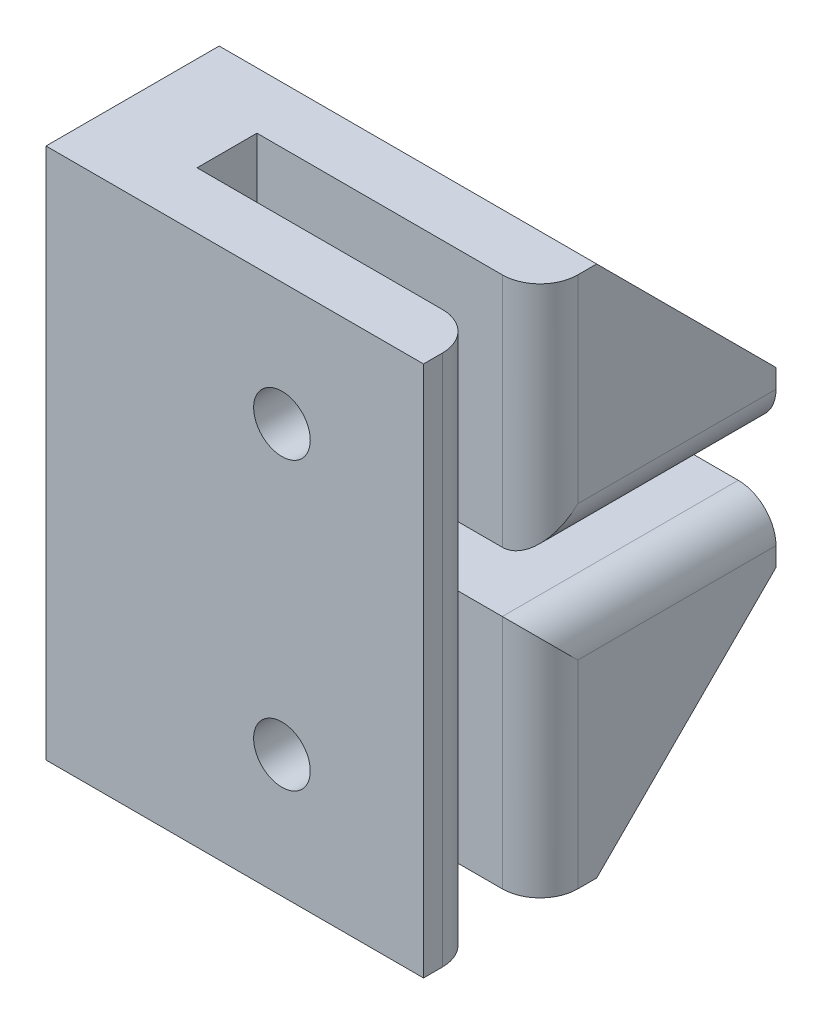
from build123d import *

# Parameters (mm, degrees)
BOSS_EXTRUDE1_DEPTH = 20
CUT_EXTRUDE1_DEPTH  = 15
FILLET1_R           = 2
SKETCH5_R           = 1.5
CUT_EXTRUDE4_DEPTH  = 32.535079673
SCALE1_SCALE        = 1.02


with BuildPart() as part:
    # Sketch1 → Boss-Extrude1 (new body)
    with BuildSketch(Plane(origin=(0, 0, 0), x_dir=(0, 0, -1), z_dir=(1, 0, 0))):
        Polygon((0, -12.5), (-3.175, -12.5), (-6.175, -12.5), (-6.175, 15.675), (-3.175, 15.675), (0, 15.675), (3, 15.675), (12.5, 6.175), (12.5, 3.175), (12.5, 0), (12.5, -3), (3, -12.5), align=None)
    extrude(amount=BOSS_EXTRUDE1_DEPTH)

    # Sketch2 → Cut-Extrude1 (cut)
    with BuildSketch(Plane(origin=(20, 0, 0), x_dir=(0, 0, -1), z_dir=(1, 0, 0))):
        Polygon((-3.175, -12.5), (0, -12.5), (0, 0), (12.5, 0), (12.5, 3.175), (0, 3.175), (0, 15.675), (-3.175, 15.675), (-3.175, 3.175), align=None)
    extrude(amount=-CUT_EXTRUDE1_DEPTH, mode=Mode.SUBTRACT)

    # Fillet1
    fillet1_edges = [part.edges().sort_by_distance(p)[0] for p in [
        (20, 1.5875, 3.175),
        (20, -6.25, 0),
        (20, 0, -6.25),
        (20, 3.175, -6.25),
        (20, 9.425, 0),
    ]]
    fillet(fillet1_edges, radius=FILLET1_R)

    # Sketch5 → Cut-Extrude4 (cut, through all)
    with BuildSketch(Plane.XY.offset(6.175)):
        with Locations(Location((12.5, 9.175, 0), (0, 0, 90))):
            Circle(SKETCH5_R)
        with Locations(Location((12.5, -6, 0), (0, 0, 90))):
            Circle(SKETCH5_R)
    extrude(amount=-CUT_EXTRUDE4_DEPTH, mode=Mode.SUBTRACT)


with BuildPart() as part_1:
    # Scale1: scaled about (9.096060395, 1.5875, -2.193637699)
    add(part.part.scale(SCALE1_SCALE).moved(Location((-0.181921208, -0.03175, 0.043872754))))


solid = part_1.part
